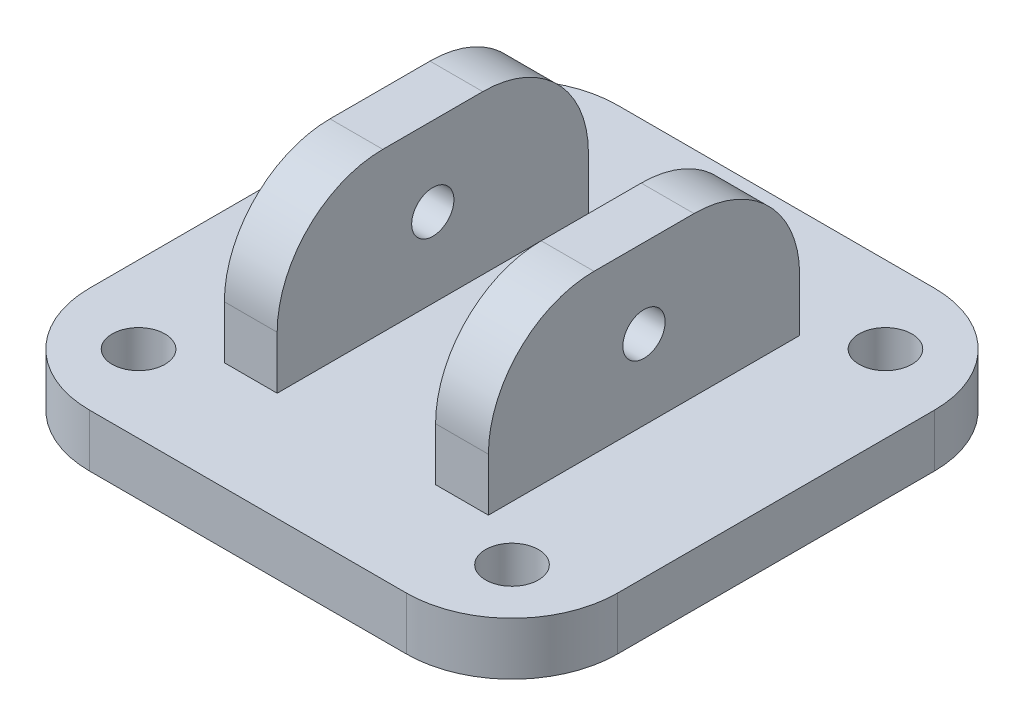
from build123d import *

# Parameters (mm, degrees)
SKETCH1_W           = 50
SKETCH1_H           = 50
SKETCH1_R           = 2.5
BOSS_EXTRUDE1_DEPTH = 5
SKETCH2_W           = 5
SKETCH2_H           = 29.468657126
BOSS_EXTRUDE2_DEPTH = 15
SKETCH3_R           = 2
CUT_EXTRUDE1_DEPTH  = 50.307707308
FILLET1_R           = 10
FILLET2_R           = 10


with BuildPart() as part:
    # Sketch1 → Boss-Extrude1 (new body)
    with BuildSketch(Plane(origin=(0, 0, 0), x_dir=(1, 0, 0), z_dir=(0, 1, 0))):
        Rectangle(SKETCH1_W, SKETCH1_H)
        with Locations(Location((-17.68, 17.68, 0), (0, 0, 270))):
            Circle(SKETCH1_R, mode=Mode.SUBTRACT)
        with Locations(Location((17.68, 17.68, 0), (0, 0, 270))):
            Circle(SKETCH1_R, mode=Mode.SUBTRACT)
        with Locations(Location((17.68, -17.68, 0), (0, 0, 90))):
            Circle(SKETCH1_R, mode=Mode.SUBTRACT)
        with Locations(Location((-17.68, -17.68, 0), (0, 0, 90))):
            Circle(SKETCH1_R, mode=Mode.SUBTRACT)
    extrude(amount=BOSS_EXTRUDE1_DEPTH)

    # Sketch2 → Boss-Extrude2 (add)
    with BuildSketch(Plane(origin=(0, 5, 0), x_dir=(1, 0, 0), z_dir=(0, 1, 0))):
        with Locations((-10, 0)):
            Rectangle(SKETCH2_W, SKETCH2_H)
        with Locations((10, 0)):
            Rectangle(SKETCH2_W, SKETCH2_H)
    extrude(amount=BOSS_EXTRUDE2_DEPTH)

    # Sketch3 → Cut-Extrude1 (cut, through all)
    with BuildSketch(Plane(origin=(12.5, 0, 0), x_dir=(0, 0, -1), z_dir=(1, 0, 0))):
        with Locations((0, 12.5)):
            Circle(SKETCH3_R)
    extrude(amount=-CUT_EXTRUDE1_DEPTH, mode=Mode.SUBTRACT)

    # Fillet1
    fillet1_edges = [part.edges().sort_by_distance(p)[0] for p in [
        (-10, 20, -14.734328563),
        (-10, 20, 14.734328563),
        (10, 20, -14.734328563),
        (10, 20, 14.734328563),
    ]]
    fillet(fillet1_edges, radius=FILLET1_R)

    # Fillet2
    fillet2_edges = [part.edges().sort_by_distance(p)[0] for p in [
        (25, 2.5, 25),
        (-25, 2.5, 25),
        (-25, 2.5, -25),
        (25, 2.5, -25),
    ]]
    fillet(fillet2_edges, radius=FILLET2_R)


solid = part.part
